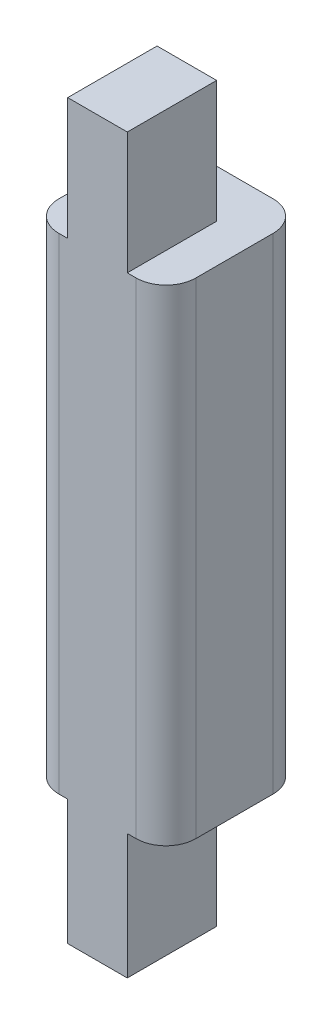
from build123d import *

# Parameters (mm, degrees)
SKETCH2_W           = 23
SKETCH2_H           = 23
BOSS_EXTRUDE1_DEPTH = 81.5
SKETCH2_3_W         = 10
SKETCH2_3_H         = 15
BOSS_EXTRUDE2_DEPTH = 21
FILLET1_R           = 5


with BuildPart() as part:
    # Sketch2 → Boss-Extrude1 (new body)
    with BuildSketch(Plane(origin=(0, 0, 0), x_dir=(1, 0, 0), z_dir=(0, 1, 0))):
        Rectangle(SKETCH2_W, SKETCH2_H)
    extrude(amount=BOSS_EXTRUDE1_DEPTH)

    # Sketch2<3> → Boss-Extrude2 (add)
    with BuildSketch(Plane(origin=(0, 0, 0), x_dir=(1, 0, 0), z_dir=(0, 1, 0))):
        with Locations((0, -4)):
            Rectangle(SKETCH2_3_W, SKETCH2_3_H)
    boss_extrude2 = extrude(amount=-BOSS_EXTRUDE2_DEPTH)

    # Fillet1
    fillet1_edges = [part.edges().sort_by_distance(p)[0] for p in [
        (-11.5, 40.75, 11.5),
        (11.5, 40.75, 11.5),
        (-11.5, 40.75, -11.5),
        (11.5, 40.75, -11.5),
    ]]
    fillet(fillet1_edges, radius=FILLET1_R)

    # Mirror1: Boss-Extrude2 across plane
    add(boss_extrude2.mirror(Plane.ZX.offset(40.486123935)))


solid = part.part
